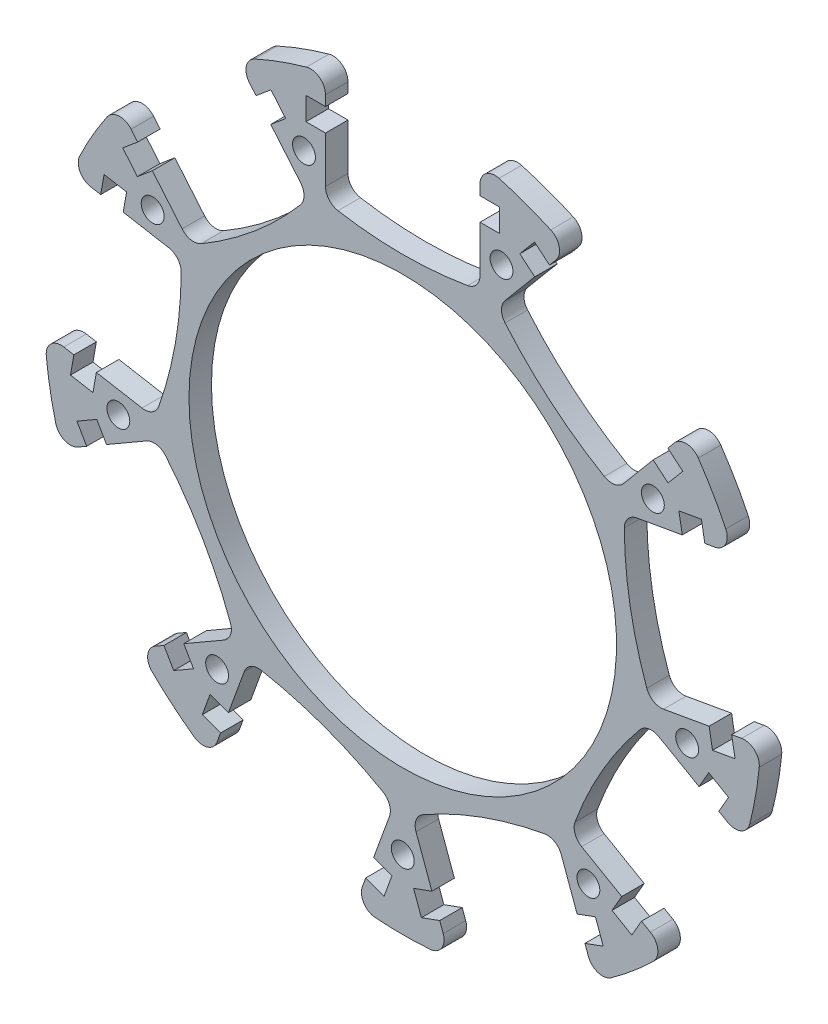
from build123d import *

# Parameters (mm, degrees)
SKETCH_1_R          = 47.75
EXTRUDE_1_DEPTH     = 3
CUT_EXTRUDE_1_DEPTH = 68.595303091
FILLET_2_R          = 2
SKETCH_3_R          = 1.525
CUT_EXTRUDE_2_DEPTH = 68.441458022
SKETCH_6_R          = 28.5
CUT_EXTRUDE_4_DEPTH = 68.441458022


with BuildPart() as part:
    # ｽｹｯﾁ1 → ﾎﾞｽ - 押し出し1 (new body)
    with BuildSketch(Plane.XY):
        Circle(SKETCH_1_R)
    extrude(amount=EXTRUDE_1_DEPTH)

    # ｽｹｯﾁ2 → ｶｯﾄ - 押し出し1 (cut, through all)
    with BuildSketch(Plane.XY.offset(3)):
        with BuildLine():
            Line((-10.3, 46.625878008), (-10.3, 42.705))
            Line((-10.3, 42.705), (-12.9, 42.705))
            Line((-12.9, 42.705), (-12.9, 39.655))
            Line((-12.9, 39.655), (-10.3, 39.655))
            Line((-10.3, 39.655), (-10.3, 31.825692416))
            ThreePointArc((-10.3, 31.825692416), (0, 30.78), (10.3, 31.825692416))
            Line((10.3, 31.825692416), (10.3, 39.655))
            Line((10.3, 39.655), (12.9, 39.655))
            Line((12.9, 39.655), (12.9, 42.705))
            Line((12.9, 42.705), (10.3, 42.705))
            Line((10.3, 42.705), (10.3, 46.625878008))
            ThreePointArc((10.3, 46.625878008), (0, 47.75), (-10.3, 46.625878008))
        make_face()
        with BuildLine():
            Line((17.599484898, 36.998204772), (12.566902991, 31.000607203))
            ThreePointArc((12.566902991, 31.000607203), (19.785002626, 23.578847959), (28.347418519, 17.759182444))
            Line((28.347418519, 17.759182444), (33.380000426, 23.756780012))
            Line((33.380000426, 23.756780012), (35.371715978, 22.085532227))
            Line((35.371715978, 22.085532227), (37.332218188, 24.421967778))
            Line((37.332218188, 24.421967778), (35.340502636, 26.093215564))
            Line((35.340502636, 26.093215564), (37.860794438, 29.096782374))
            ThreePointArc((37.860794438, 29.096782374), (30.693108363, 36.578622159), (22.08027891, 42.338207133))
            Line((22.08027891, 42.338207133), (19.559987108, 39.334640323))
            Line((19.559987108, 39.334640323), (17.568271555, 41.005888108))
            Line((17.568271555, 41.005888108), (15.607769346, 38.669452557))
            Line((15.607769346, 38.669452557), (17.599484898, 36.998204772))
        make_face()
        with BuildLine():
            Line((37.263975216, 17.029538341), (29.553612406, 15.669993347))
            ThreePointArc((29.553612406, 15.669993347), (30.312382638, 5.344890909), (33.130764866, -4.617046365))
            Line((33.130764866, -4.617046365), (40.841127676, -3.257501371))
            Line((40.841127676, -3.257501371), (41.292612938, -5.818001528))
            Line((41.292612938, -5.818001528), (44.296276584, -5.288374587))
            Line((44.296276584, -5.288374587), (43.844791322, -2.727874429))
            Line((43.844791322, -2.727874429), (47.706102383, -2.047021108))
            ThreePointArc((47.706102383, -2.047021108), (47.024570206, 8.291700484), (44.128949923, 18.240018604))
            Line((44.128949923, 18.240018604), (40.267638862, 17.559165283))
            Line((40.267638862, 17.559165283), (39.8161536, 20.119665441))
            Line((39.8161536, 20.119665441), (36.812489954, 19.590038499))
            Line((36.812489954, 19.590038499), (37.263975216, 17.029538341))
        make_face()
        with BuildLine():
            Line((39.492237387, -10.907438341), (32.711858125, -6.992784549))
            ThreePointArc((32.711858125, -6.992784549), (26.656261928, -15.39), (22.411858125, -24.832907867))
            Line((22.411858125, -24.832907867), (29.192237387, -28.747561659))
            Line((29.192237387, -28.747561659), (27.892237387, -30.999227709))
            Line((27.892237387, -30.999227709), (30.533614869, -32.524227709))
            Line((30.533614869, -32.524227709), (31.833614869, -30.272561659))
            Line((31.833614869, -30.272561659), (35.229194829, -32.233000663))
            ThreePointArc((35.229194829, -32.233000663), (41.352713031, -23.875), (45.529194829, -14.392877345))
            Line((45.529194829, -14.392877345), (42.133614869, -12.432438341))
            Line((42.133614869, -12.432438341), (43.433614869, -10.180772291))
            Line((43.433614869, -10.180772291), (40.792237387, -8.655772291))
            Line((40.792237387, -8.655772291), (39.492237387, -10.907438341))
        make_face()
        with BuildLine():
            Line((23.241642778, -33.740703401), (20.563861876, -26.383560838))
            ThreePointArc((20.563861876, -26.383560838), (10.527380012, -28.923738868), (1.206193887, -33.429175791))
            Line((1.206193887, -33.429175791), (3.883974789, -40.786318354))
            Line((3.883974789, -40.786318354), (1.440773975, -41.675570726))
            Line((1.440773975, -41.675570726), (2.483935413, -44.54163322))
            Line((2.483935413, -44.54163322), (4.927136227, -43.652380847))
            Line((4.927136227, -43.652380847), (6.268155485, -47.336800978))
            ThreePointArc((6.268155485, -47.336800978), (16.331461844, -44.870322643), (25.625823473, -40.291186025))
            Line((25.625823473, -40.291186025), (24.284804215, -36.606765894))
            Line((24.284804215, -36.606765894), (26.728005029, -35.717513522))
            Line((26.728005029, -35.717513522), (25.684843592, -32.851451028))
            Line((25.684843592, -32.851451028), (23.241642778, -33.740703401))
        make_face()
        with BuildLine():
            Line((-3.883974789, -40.786318354), (-1.206193887, -33.429175791))
            ThreePointArc((-1.206193887, -33.429175791), (-10.527380012, -28.923738868), (-20.563861876, -26.383560838))
            Line((-20.563861876, -26.383560838), (-23.241642778, -33.740703401))
            Line((-23.241642778, -33.740703401), (-25.684843592, -32.851451028))
            Line((-25.684843592, -32.851451028), (-26.728005029, -35.717513522))
            Line((-26.728005029, -35.717513522), (-24.284804215, -36.606765894))
            Line((-24.284804215, -36.606765894), (-25.625823473, -40.291186025))
            ThreePointArc((-25.625823473, -40.291186025), (-16.331461844, -44.870322643), (-6.268155485, -47.336800978))
            Line((-6.268155485, -47.336800978), (-4.927136227, -43.652380847))
            Line((-4.927136227, -43.652380847), (-2.483935413, -44.54163322))
            Line((-2.483935413, -44.54163322), (-1.440773975, -41.675570726))
            Line((-1.440773975, -41.675570726), (-3.883974789, -40.786318354))
        make_face()
        with BuildLine():
            Line((-29.192237387, -28.747561659), (-22.411858125, -24.832907867))
            ThreePointArc((-22.411858125, -24.832907867), (-26.656261928, -15.39), (-32.711858125, -6.992784549))
            Line((-32.711858125, -6.992784549), (-39.492237387, -10.907438341))
            Line((-39.492237387, -10.907438341), (-40.792237387, -8.655772291))
            Line((-40.792237387, -8.655772291), (-43.433614869, -10.180772291))
            Line((-43.433614869, -10.180772291), (-42.133614869, -12.432438341))
            Line((-42.133614869, -12.432438341), (-45.529194829, -14.392877345))
            ThreePointArc((-45.529194829, -14.392877345), (-41.352713031, -23.875), (-35.229194829, -32.233000663))
            Line((-35.229194829, -32.233000663), (-31.833614869, -30.272561659))
            Line((-31.833614869, -30.272561659), (-30.533614869, -32.524227709))
            Line((-30.533614869, -32.524227709), (-27.892237387, -30.999227709))
            Line((-27.892237387, -30.999227709), (-29.192237387, -28.747561659))
        make_face()
        with BuildLine():
            Line((-40.841127676, -3.257501371), (-33.130764866, -4.617046365))
            ThreePointArc((-33.130764866, -4.617046365), (-30.312382638, 5.344890909), (-29.553612406, 15.669993347))
            Line((-29.553612406, 15.669993347), (-37.263975216, 17.029538341))
            Line((-37.263975216, 17.029538341), (-36.812489954, 19.590038499))
            Line((-36.812489954, 19.590038499), (-39.8161536, 20.119665441))
            Line((-39.8161536, 20.119665441), (-40.267638862, 17.559165283))
            Line((-40.267638862, 17.559165283), (-44.128949923, 18.240018604))
            ThreePointArc((-44.128949923, 18.240018604), (-47.024570206, 8.291700484), (-47.706102383, -2.047021108))
            Line((-47.706102383, -2.047021108), (-43.844791322, -2.727874429))
            Line((-43.844791322, -2.727874429), (-44.296276584, -5.288374587))
            Line((-44.296276584, -5.288374587), (-41.292612938, -5.818001528))
            Line((-41.292612938, -5.818001528), (-40.841127676, -3.257501371))
        make_face()
        with BuildLine():
            Line((-33.380000426, 23.756780012), (-28.347418519, 17.759182444))
            ThreePointArc((-28.347418519, 17.759182444), (-19.785002626, 23.578847959), (-12.566902991, 31.000607203))
            Line((-12.566902991, 31.000607203), (-17.599484898, 36.998204772))
            Line((-17.599484898, 36.998204772), (-15.607769346, 38.669452557))
            Line((-15.607769346, 38.669452557), (-17.568271555, 41.005888108))
            Line((-17.568271555, 41.005888108), (-19.559987108, 39.334640323))
            Line((-19.559987108, 39.334640323), (-22.08027891, 42.338207133))
            ThreePointArc((-22.08027891, 42.338207133), (-30.693108363, 36.578622159), (-37.860794438, 29.096782374))
            Line((-37.860794438, 29.096782374), (-35.340502636, 26.093215564))
            Line((-35.340502636, 26.093215564), (-37.332218188, 24.421967778))
            Line((-37.332218188, 24.421967778), (-35.371715978, 22.085532227))
            Line((-35.371715978, 22.085532227), (-33.380000426, 23.756780012))
        make_face()
    extrude(amount=-CUT_EXTRUDE_1_DEPTH, mode=Mode.SUBTRACT)

    # ﾌｨﾚｯﾄ2
    fillet_2_edges = [part.edges().sort_by_distance(p)[0] for p in [
        (-47.706102383, -2.047021108, 1.5),
        (-44.128949923, 18.240018604, 1.5),
        (-29.553612406, 15.669993347, 1.5),
        (-33.130764866, -4.617046365, 1.5),
        (-37.860794438, 29.096782374, 1.5),
        (-22.08027891, 42.338207133, 1.5),
        (-12.566902991, 31.000607203, 1.5),
        (-28.347418519, 17.759182444, 1.5),
        (-6.268155485, -47.336800978, 1.5),
        (-25.625823473, -40.291186025, 1.5),
        (-20.563861876, -26.383560838, 1.5),
        (-1.206193887, -33.429175791, 1.5),
        (-35.229194829, -32.233000663, 1.5),
        (-45.529194829, -14.392877345, 1.5),
        (-32.711858125, -6.992784549, 1.5),
        (-22.411858125, -24.832907867, 1.5),
        (45.529194829, -14.392877345, 1.5),
        (35.229194829, -32.233000663, 1.5),
        (22.411858125, -24.832907867, 1.5),
        (32.711858125, -6.992784549, 1.5),
        (25.625823473, -40.291186025, 1.5),
        (6.268155485, -47.336800978, 1.5),
        (1.206193887, -33.429175791, 1.5),
        (20.563861876, -26.383560838, 1.5),
        (22.08027891, 42.338207133, 1.5),
        (37.860794438, 29.096782374, 1.5),
        (28.347418519, 17.759182444, 1.5),
        (12.566902991, 31.000607203, 1.5),
        (44.128949923, 18.240018604, 1.5),
        (47.706102383, -2.047021108, 1.5),
        (33.130764866, -4.617046365, 1.5),
        (29.553612406, 15.669993347, 1.5),
        (-10.3, 46.625878008, 1.5),
        (10.3, 46.625878008, 1.5),
        (10.3, 31.825692416, 1.5),
        (-10.3, 31.825692416, 1.5),
    ]]
    fillet(fillet_2_edges, radius=FILLET_2_R)

    # ｽｹｯﾁ3 → ｶｯﾄ - 押し出し2 (cut, through all)
    with BuildSketch(Plane.XY.offset(3)):
        with Locations((0, -38.5)):
            Circle(SKETCH_3_R)
        with Locations((-24.747322973, -29.49271106)):
            Circle(SKETCH_3_R)
        with Locations((-37.915098491, -6.68545484)):
            Circle(SKETCH_3_R)
        with Locations((-33.341978046, 19.25)):
            Circle(SKETCH_3_R)
        with Locations((-13.167775518, 36.1781659)):
            Circle(SKETCH_3_R)
        with Locations((13.167775518, 36.1781659)):
            Circle(SKETCH_3_R)
        with Locations((33.341978046, 19.25)):
            Circle(SKETCH_3_R)
        with Locations((37.915098491, -6.68545484)):
            Circle(SKETCH_3_R)
        with Locations((24.747322973, -29.49271106)):
            Circle(SKETCH_3_R)
    extrude(amount=-CUT_EXTRUDE_2_DEPTH, mode=Mode.SUBTRACT)

    # ｽｹｯﾁ6 → ｶｯﾄ - 押し出し4 (cut, through all)
    with BuildSketch(Plane(origin=(0, 0, 0), x_dir=(-1, 0, 0), z_dir=(0, 0, -1))):
        Circle(SKETCH_6_R)
    extrude(amount=-CUT_EXTRUDE_4_DEPTH, mode=Mode.SUBTRACT)


solid = part.part
